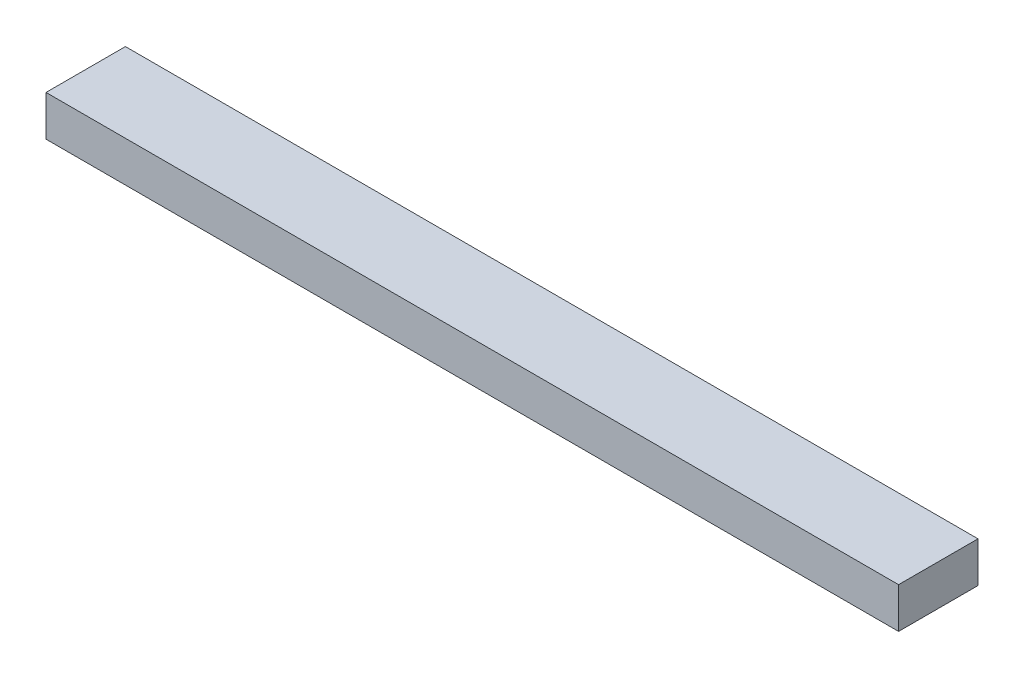
from build123d import *

# Parameters (mm, degrees)
SKETCH1_W           = 267.3
SKETCH1_H           = 12.7
BOSS_EXTRUDE1_DEPTH = 24.9


with BuildPart() as part:
    # Sketch1 → Boss-Extrude1 (new body)
    with BuildSketch(Plane.XY):
        with Locations((317.715660481, -31.632992431)):
            Rectangle(SKETCH1_W, SKETCH1_H)
    extrude(amount=BOSS_EXTRUDE1_DEPTH)


solid = part.part
